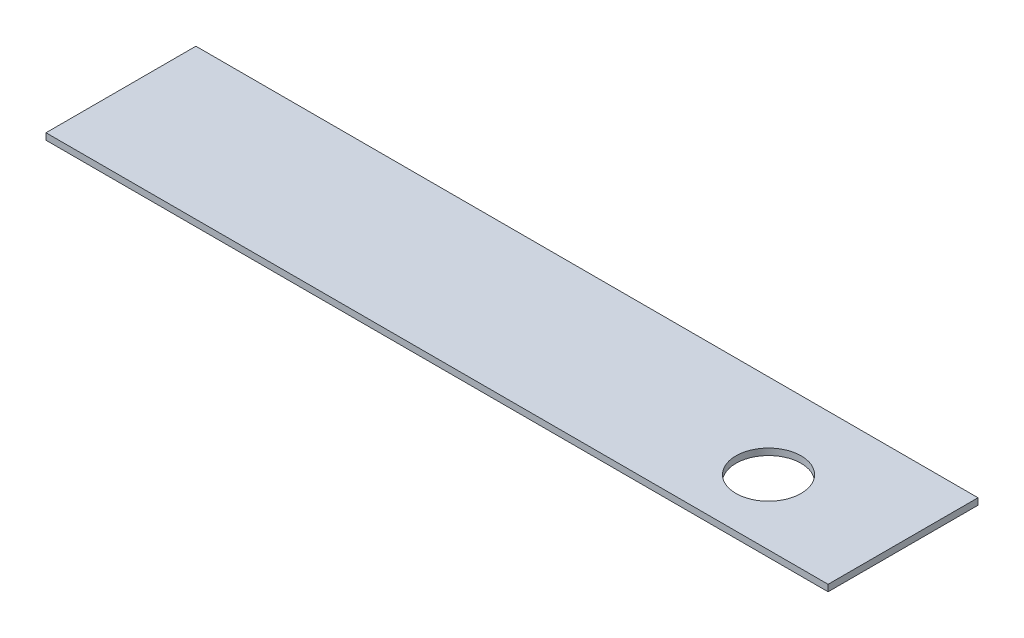
from build123d import *

# Parameters (mm, degrees)
SKETCH1_W           = 240
SKETCH1_H           = 2
BOSS_EXTRUDE1_DEPTH = 46
SKETCH2_R           = 10
CUT_EXTRUDE1_DEPTH  = 2


with BuildPart() as part:
    # Sketch1 → Boss-Extrude1 (new body)
    with BuildSketch(Plane.XY):
        with Locations((179.490005303, -217.429379744)):
            Rectangle(SKETCH1_W, SKETCH1_H)
    extrude(amount=BOSS_EXTRUDE1_DEPTH)

    # Sketch2 → Cut-Extrude1 (cut)
    with BuildSketch(Plane(origin=(0, -216.429379744, 0), x_dir=(1, 0, 0), z_dir=(0, 1, 0))):
        with Locations(Location((261.207431356, -26, 0), (0, 0, 180))):
            Circle(SKETCH2_R)
    extrude(amount=-CUT_EXTRUDE1_DEPTH, mode=Mode.SUBTRACT)


solid = part.part
